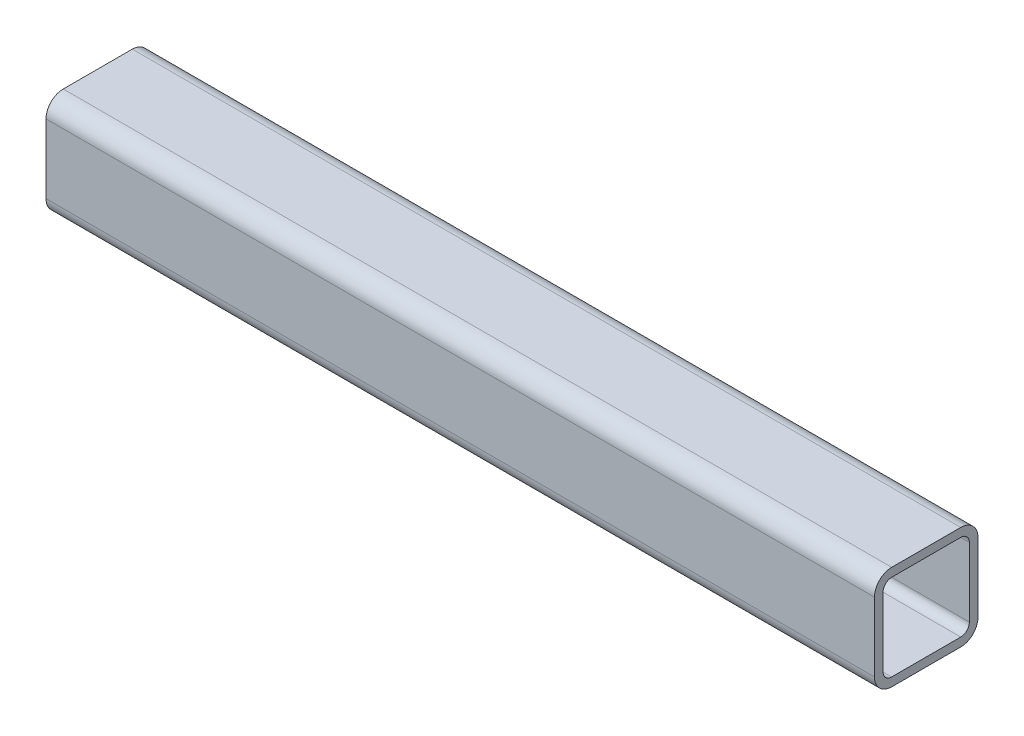
from build123d import *

# Parameters (mm, degrees)
STRUCTURAL_MEMBER1_DEPTH = 609.6


with BuildPart() as part:
    # Sketch1 → Structural Member1 (new body)
    with BuildSketch(Plane.ZY):
        with BuildLine():
            Line((-25.4, -38.1), (25.4, -38.1))
            ThreePointArc((25.4, -38.1), (34.380256121, -34.380256121), (38.1, -25.4))
            Line((38.1, -25.4), (38.1, 25.4))
            ThreePointArc((38.1, 25.4), (34.380256121, 34.380256121), (25.4, 38.1))
            Line((25.4, 38.1), (-25.4, 38.1))
            ThreePointArc((-25.4, 38.1), (-34.380256121, 34.380256121), (-38.1, 25.4))
            Line((-38.1, 25.4), (-38.1, -25.4))
            ThreePointArc((-38.1, -25.4), (-34.380256121, -34.380256121), (-25.4, -38.1))
        make_face()
        with BuildLine():
            Line((-25.4, -31.75), (25.4, -31.75))
            ThreePointArc((25.4, -31.75), (29.890128061, -29.890128061), (31.75, -25.4))
            Line((31.75, -25.4), (31.75, 25.4))
            ThreePointArc((31.75, 25.4), (29.890128061, 29.890128061), (25.4, 31.75))
            Line((25.4, 31.75), (-25.4, 31.75))
            ThreePointArc((-25.4, 31.75), (-29.890128061, 29.890128061), (-31.75, 25.4))
            Line((-31.75, 25.4), (-31.75, -25.4))
            ThreePointArc((-31.75, -25.4), (-29.890128061, -29.890128061), (-25.4, -31.75))
        make_face(mode=Mode.SUBTRACT)
    extrude(amount=STRUCTURAL_MEMBER1_DEPTH)


solid = part.part
